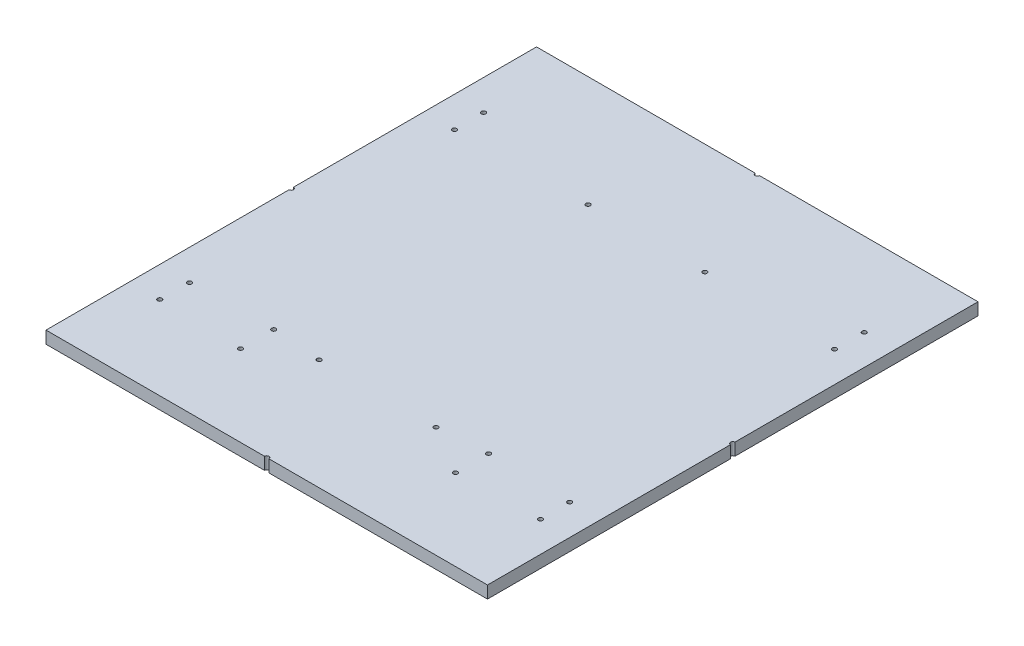
from build123d import *

# Parameters (mm, degrees)
SKETCH1_W             = 228.6
SKETCH1_H             = 254
BOSS_EXTRUDE1_DEPTH   = 6.35
F_4_40_TAPPED_HOLE1_D = 2.2606
F_4_40_TAPPED_HOLE2_D = 2.2606


with BuildPart() as part:
    # Sketch1 → Boss-Extrude1 (new body)
    with BuildSketch(Plane(origin=(0, 0, 0), x_dir=(1, 0, 0), z_dir=(0, 1, 0))):
        with Locations((114.3, 127)):
            Rectangle(SKETCH1_W, SKETCH1_H)
    extrude(amount=BOSS_EXTRUDE1_DEPTH)

    # #4-40 Tapped Hole1 (through all)
    with Locations(Plane(origin=(0, 6.35, 0), x_dir=(1, 0, 0), z_dir=(0, 1, 0))):
        with Locations((15.735159407, 43.18), (15.875, 58.42), (84.05884141, 57.388437181), (144.561688198, 57.388437181), (0, 127), (144.561688198, 196.611562819), (84.05884141, 196.611562819), (15.875, 195.58), (15.735159407, 210.82), (114.3, 0), (212.864840593, 43.18), (212.725, 58.42), (212.864840593, 210.82), (212.725, 195.58), (228.6, 127), (114.3, 254)):
            Hole(F_4_40_TAPPED_HOLE1_D / 2)

    # #4-40 Tapped Hole2 (through all)
    with Locations(Plane(origin=(0, 6.35, 0), x_dir=(1, 0, 0), z_dir=(0, 1, 0))):
        with Locations((58.65884141, 59.18949303), (58.65884141, 42.0497), (169.961688198, 59.18949303), (169.961688198, 42.0497)):
            Hole(F_4_40_TAPPED_HOLE2_D / 2)


solid = part.part
